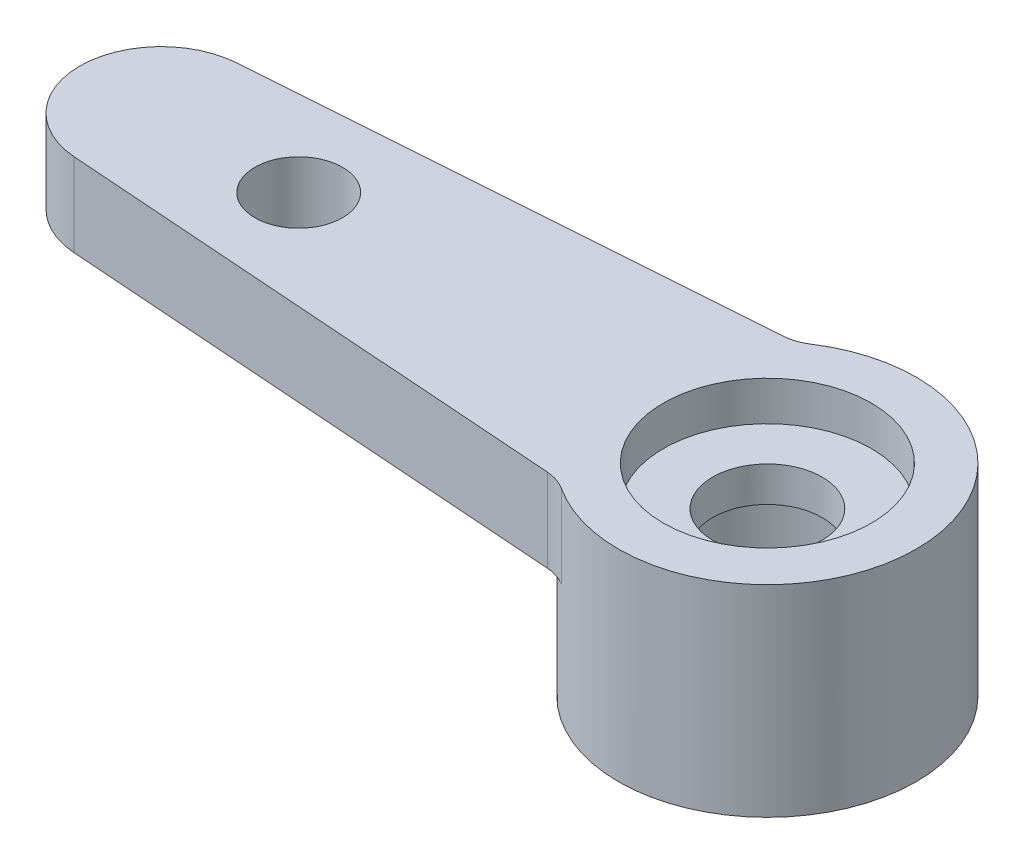
from build123d import *

# Parameters (mm, degrees)
SKETCH1_R           = 3.4
BOSS_EXTRUDE1_DEPTH = 4.6
BOSS_EXTRUDE2_START = -1.9
BOSS_EXTRUDE2_DEPTH = 1.9
SKETCH4_R           = 2.325
CUT_EXTRUDE1_DEPTH  = 2.9
FILLET1_R           = 1
CUT_EXTRUDE2_REACH  = 18.71
SKETCH5_R           = 1.25
SKETCH6_R           = 2.375
CUT_EXTRUDE3_DEPTH  = 0.9
CUT_EXTRUDE4_REACH  = 18.71
SKETCH7_R           = 1


with BuildPart() as part:
    # Sketch1 → Boss-Extrude1 (new body)
    with BuildSketch(Plane(origin=(0, 0, 0), x_dir=(1, 0, 0), z_dir=(0, 1, 0))):
        with Locations(Location((0, 0, 0), (0, 0, 270))):
            Circle(SKETCH1_R)
    extrude(amount=BOSS_EXTRUDE1_DEPTH)

    # Sketch3 → Boss-Extrude2 (add)
    with BuildSketch(Plane(origin=(0, 4.6, 0), x_dir=(1, 0, 0), z_dir=(0, 1, 0)).offset(BOSS_EXTRUDE2_START)):
        with BuildLine():
            Line((-13.973038518, -1.855236037), (-2.053265692, -2.71))
            ThreePointArc((-2.053265692, -2.71), (3.4, 0), (-2.053265692, 2.71))
            Line((-2.053265692, 2.71), (-13.973038518, 1.855236037))
            ThreePointArc((-13.973038518, 1.855236037), (-15.7, 0), (-13.973038518, -1.855236037))
        make_face()
    extrude(amount=BOSS_EXTRUDE2_DEPTH)

    # Sketch4 → Cut-Extrude1 (cut)
    with BuildSketch(Plane.XZ):
        with Locations(Location((0, 0, 0), (0, 0, 270))):
            Circle(SKETCH4_R)
    extrude(amount=-CUT_EXTRUDE1_DEPTH, mode=Mode.SUBTRACT)

    # Fillet1
    fillet1_edges = [part.edges().sort_by_distance(p)[0] for p in [
        (-2.053265692, 3.65, -2.71),
        (-2.053265692, 3.65, 2.71),
    ]]
    fillet(fillet1_edges, radius=FILLET1_R)

    # Sketch5 → Cut-Extrude2 (cut, up to next)
    with BuildSketch(Plane(origin=(0, 4.6, 0), x_dir=(1, 0, 0), z_dir=(0, 1, 0)), mode=Mode.PRIVATE) as cut_extrude2_sk1:
        with Locations(Location((0, 0, 0), (0, 0, 270))):
            Circle(SKETCH5_R)
    cut_extrude2_tool1 = extrude(cut_extrude2_sk1.sketch, amount=-CUT_EXTRUDE2_REACH, mode=Mode.PRIVATE) & part.part
    add(cut_extrude2_tool1.solids().sort_by_distance((0, 4.6, 0))[0], mode=Mode.SUBTRACT)

    # Sketch6 → Cut-Extrude3 (cut)
    with BuildSketch(Plane(origin=(0, 4.6, 0), x_dir=(1, 0, 0), z_dir=(0, 1, 0))):
        with Locations(Location((0, 0, 0), (0, 0, 270))):
            Circle(SKETCH6_R)
    extrude(amount=-CUT_EXTRUDE3_DEPTH, mode=Mode.SUBTRACT)

    # Sketch7 → Cut-Extrude4 (cut, up to next)
    with BuildSketch(Plane(origin=(0, 4.6, 0), x_dir=(1, 0, 0), z_dir=(0, 1, 0)), mode=Mode.PRIVATE) as cut_extrude4_sk1:
        with Locations(Location((-10.7, 0, 0), (0, 0, 270))):
            Circle(SKETCH7_R)
    cut_extrude4_tool1 = extrude(cut_extrude4_sk1.sketch, amount=-CUT_EXTRUDE4_REACH, mode=Mode.PRIVATE) & part.part
    add(cut_extrude4_tool1.solids().sort_by_distance((-10.7, 4.6, 0))[0], mode=Mode.SUBTRACT)


solid = part.part
